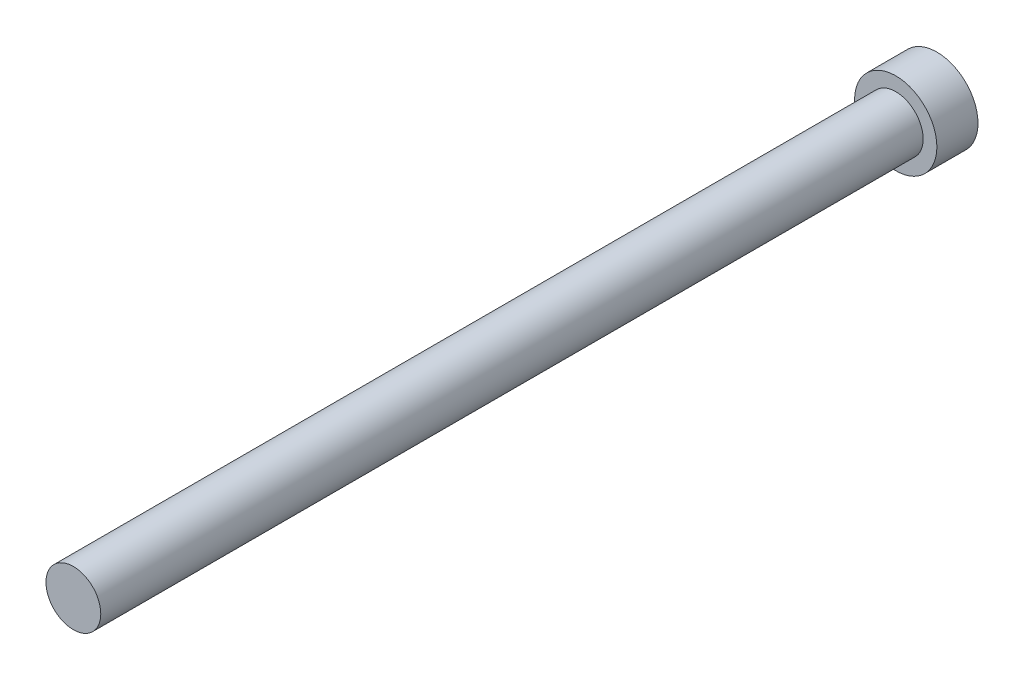
from build123d import *

# Parameters (mm, degrees)
SKETCH_1_R      = 6
EXTRUDE_1_DEPTH = 6
SKETCH_2_R      = 4
EXTRUDE_2_DEPTH = 120


with BuildPart() as part:
    # 草图1 → 凸台-拉伸1 (new body)
    with BuildSketch(Plane.XY):
        Circle(SKETCH_1_R)
        Polygon((3.464101615, 0), (1.732050808, 3), (-1.732050808, 3), (-3.464101615, 0), (-1.732050808, -3), (1.732050808, -3), align=None, mode=Mode.SUBTRACT)
    extrude(amount=EXTRUDE_1_DEPTH)

    # 草图2 → 凸台-拉伸2 (add)
    with BuildSketch(Plane.XY.offset(6)):
        Circle(SKETCH_2_R)
    extrude(amount=EXTRUDE_2_DEPTH)


solid = part.part
